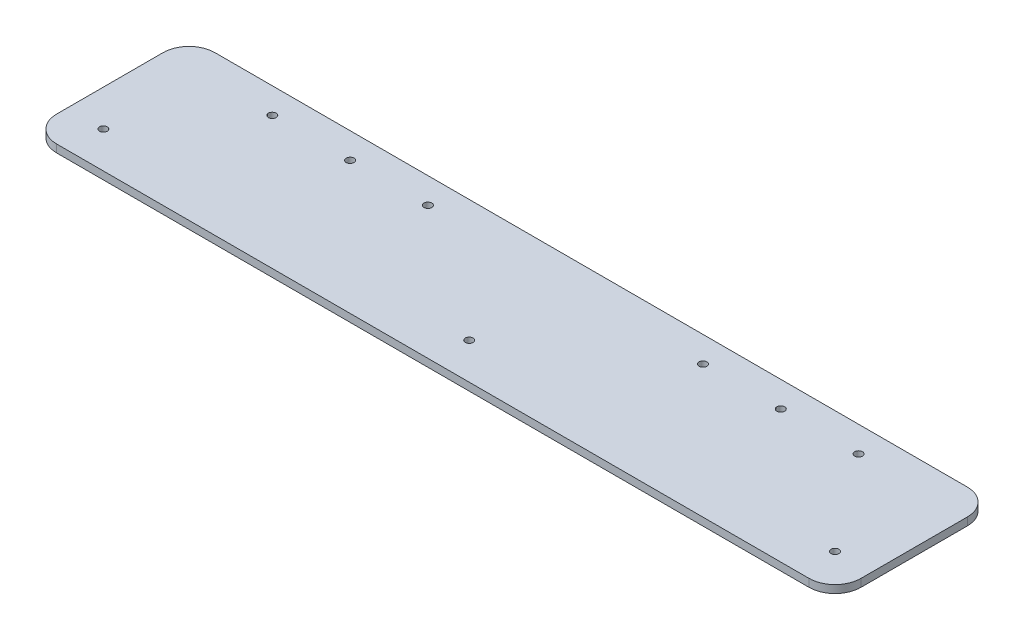
from build123d import *

# Parameters (mm, degrees)
SKETCH_1_R      = 1.5
EXTRUDE_1_DEPTH = 3


with BuildPart() as part:
    # 草图1 → 凸台-拉伸1 (new body)
    with BuildSketch(Plane(origin=(0, 0, 0), x_dir=(1, 0, 0), z_dir=(0, 1, 0))):
        with BuildLine():
            Line((10, -220), (300, -220))
            ThreePointArc((300, -220), (307.071067812, -217.071067812), (310, -210))
            Line((310, -210), (310, -169))
            ThreePointArc((310, -169), (307.071067812, -161.928932188), (300, -159))
            Line((300, -159), (10, -159))
            ThreePointArc((10, -159), (2.928932188, -161.928932188), (0, -169))
            Line((0, -169), (0, -210))
            ThreePointArc((0, -210), (2.928932188, -217.071067812), (10, -220))
        make_face()
        with Locations(Location((14, -206, 0), (0, 0, 270))):
            Circle(SKETCH_1_R, mode=Mode.SUBTRACT)
        with Locations(Location((296, -206, 0), (0, 0, 270))):
            Circle(SKETCH_1_R, mode=Mode.SUBTRACT)
        with Locations(Location((155, -206, 0), (0, 0, 270))):
            Circle(SKETCH_1_R, mode=Mode.SUBTRACT)
        with Locations(Location((72, -168.903225806, 0), (0, 0, 270))):
            Circle(SKETCH_1_R, mode=Mode.SUBTRACT)
        with Locations(Location((42, -168.903225806, 0), (0, 0, 270))):
            Circle(SKETCH_1_R, mode=Mode.SUBTRACT)
        with Locations(Location((102, -168.903225806, 0), (0, 0, 270))):
            Circle(SKETCH_1_R, mode=Mode.SUBTRACT)
        with Locations(Location((238, -168.903225806, 0), (0, 0, 270))):
            Circle(SKETCH_1_R, mode=Mode.SUBTRACT)
        with Locations(Location((268, -168.903225806, 0), (0, 0, 270))):
            Circle(SKETCH_1_R, mode=Mode.SUBTRACT)
        with Locations(Location((208, -168.903225806, 0), (0, 0, 270))):
            Circle(SKETCH_1_R, mode=Mode.SUBTRACT)
    extrude(amount=EXTRUDE_1_DEPTH)


solid = part.part
